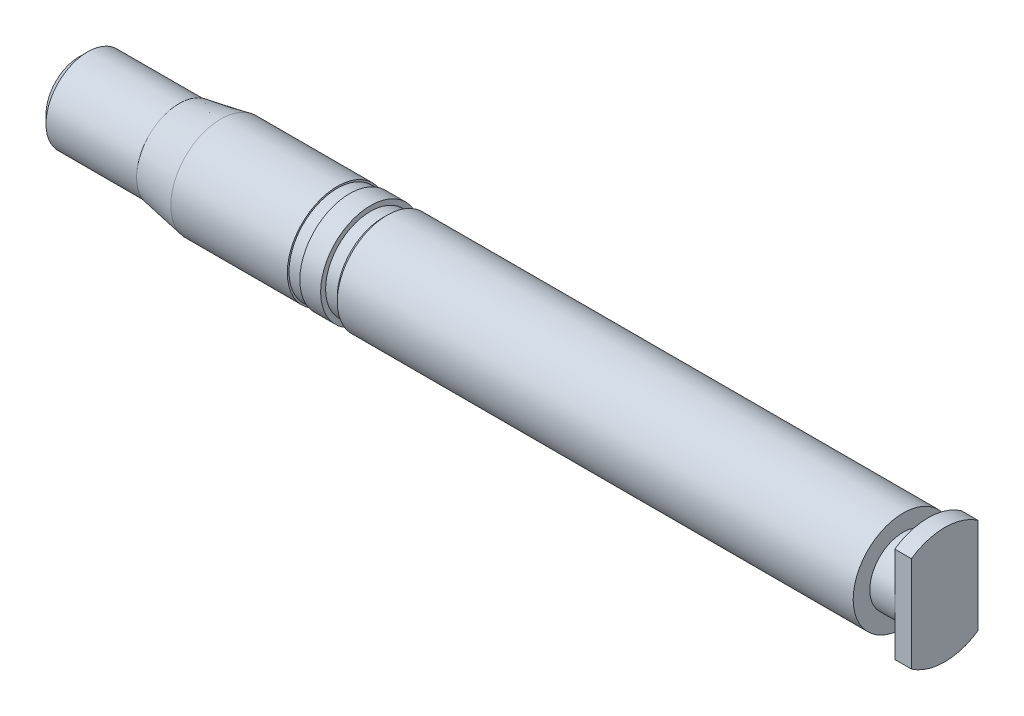
from build123d import *

# Parameters (mm, degrees)
CHANFREIN1_SIZE         = 1
CHANFREIN2_SIZE         = 0.5
ENL_V_MAT_EXTRU_1_REACH = 106.47
ESQUISSE2_W             = 5.137351374
ESQUISSE2_H             = 15.268552686


with BuildPart() as part:
    # Esquisse1 → Révolution1 (revolve)
    with BuildSketch(Plane.XY, mode=Mode.PRIVATE) as r_volution1_sk:
        Polygon((0, 0), (0, 5), (12, 5), (12, 5.118365096), (17, 6), (31, 6), (31, 5.8), (32.5, 5.8), (32.5, 6), (35, 6), (35, 5.4), (36.5, 5.4), (36.5, 6), (99, 6), (99, 4), (102, 4), (102, 7), (104, 7), (104, 0), (103.330760558, 0), align=None)
    revolve(r_volution1_sk.sketch.rotate(Axis((0, 0, 0), (1, 0, 0)), 90), axis=Axis((0, 0, 0), (1, 0, 0)))

    # Chanfrein1
    chanfrein1_edges = [part.edges().sort_by_distance(p)[0] for p in [
        (0, 0, -5),
    ]]
    chamfer(chanfrein1_edges, length=CHANFREIN1_SIZE)

    # Chanfrein2
    chanfrein2_edges = [part.edges().sort_by_distance(p)[0] for p in [
        (36.5, 0, -6),
    ]]
    chamfer(chanfrein2_edges, length=CHANFREIN2_SIZE)

    # Esquisse2 → Enlèv. mat.-Extru.1 (cut, up to next)
    with BuildSketch(Plane(origin=(104, 0, 0), x_dir=(0, 0, -1), z_dir=(1, 0, 0)), mode=Mode.PRIVATE) as enl_v_mat_extru_1_sk1:
        with Locations((-6.568675687, -0.086100861)):
            Rectangle(ESQUISSE2_W, ESQUISSE2_H)
    enl_v_mat_extru_1_tool1 = extrude(enl_v_mat_extru_1_sk1.sketch, amount=-ENL_V_MAT_EXTRU_1_REACH, mode=Mode.PRIVATE) & part.part
    # Esquisse2 → Enlèv. mat.-Extru.1 (cut, up to next)
    with BuildSketch(Plane(origin=(104, 0, 0), x_dir=(0, 0, -1), z_dir=(1, 0, 0)), mode=Mode.PRIVATE) as enl_v_mat_extru_1_sk2:
        with Locations((6.568675687, -0.086100861)):
            Rectangle(ESQUISSE2_W, ESQUISSE2_H)
    enl_v_mat_extru_1_tool2 = extrude(enl_v_mat_extru_1_sk2.sketch, amount=-ENL_V_MAT_EXTRU_1_REACH, mode=Mode.PRIVATE) & part.part
    add(enl_v_mat_extru_1_tool1.solids().sort_by_distance((104, -0.086101, 6.568676))[0], mode=Mode.SUBTRACT)
    add(enl_v_mat_extru_1_tool2.solids().sort_by_distance((104, -0.086101, -6.568676))[0], mode=Mode.SUBTRACT)


solid = part.part
